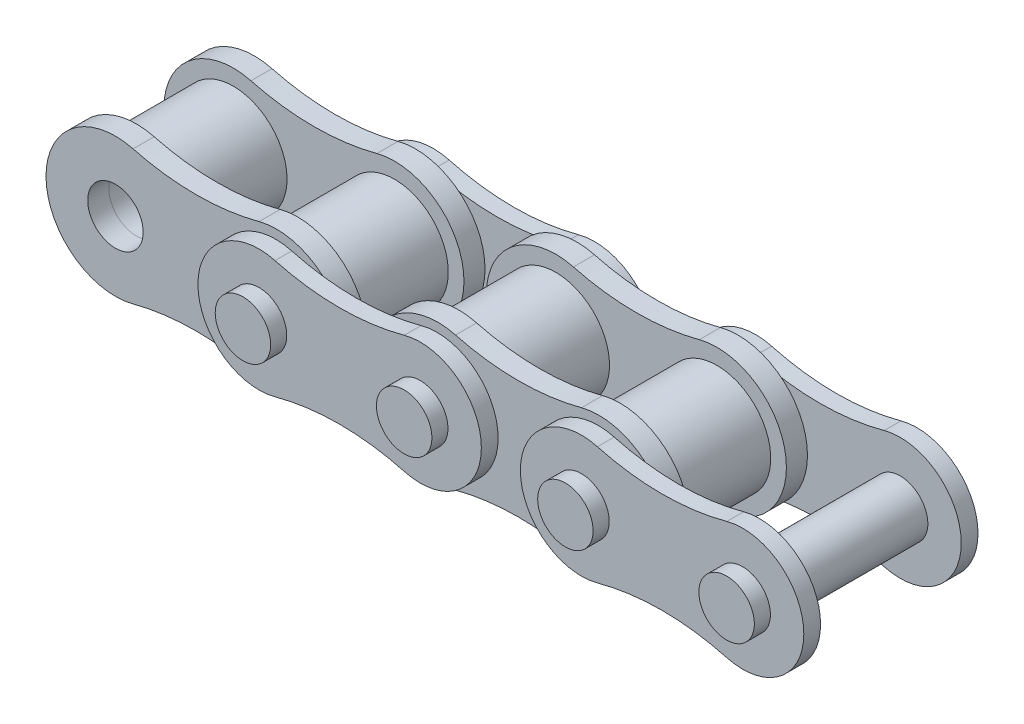
from build123d import *

# Parameters (mm, degrees)
SKETCH4_R                  = 3.175
SKETCH4_R_2                = 1.6637
BOSS_EXTRUDE1_DEPTH        = 2.86
BOSS_EXTRUDE1_2_DEPTH      = 2.86
SKETCH5_R                  = 1.6383
BOSS_EXTRUDE2_DEPTH        = 1.2446
LPATTERN1_COUNT            = 2
LPATTERN1_PITCH            = 9.525
SKETCH7_R                  = 1.6383
BOSS_EXTRUDE3_DEPTH        = 0.9906
BOSS_EXTRUDE4_DEPTH        = 6.096
BOSS_EXTRUDE4_DEPTH_BACK   = 6.096
SKETCH8_R                  = 1.6383
BOSS_EXTRUDE4_2_DEPTH      = 6.096
BOSS_EXTRUDE4_2_DEPTH_BACK = 6.096
LPATTERN2_COUNT            = 2
LPATTERN2_PITCH            = 19.05


with BuildPart() as part:
    # Sketch4 → Boss-Extrude1 (new, symmetric)
    with BuildSketch(Plane.XY):
        with Locations((-4.7625, 0)):
            Circle(SKETCH4_R)
        with Locations((-4.7625, 0)):
            Circle(SKETCH4_R_2, mode=Mode.SUBTRACT)
    extrude(amount=BOSS_EXTRUDE1_DEPTH, both=True)


with BuildPart() as body_2:
    # Sketch4 → Boss-Extrude1 2 (new, symmetric)
    with BuildSketch(Plane.XY):
        with Locations((4.7625, 0)):
            Circle(SKETCH4_R)
        with Locations((4.7625, 0)):
            Circle(SKETCH4_R_2, mode=Mode.SUBTRACT)
    extrude(amount=BOSS_EXTRUDE1_2_DEPTH, both=True)


with BuildPart() as body_3:
    # Sketch5 → Boss-Extrude2 (new body)
    with BuildSketch(Plane.XY.offset(2.86)):
        with BuildLine():
            ThreePointArc((-3.71992076, 3.967398762), (-8.8646, 0), (-3.71992076, -3.967398762))
            ThreePointArc((-3.71992076, -3.967398762), (0, -3.486785), (3.71992076, -3.967398762))
            ThreePointArc((3.71992076, -3.967398762), (8.8646, 0), (3.71992076, 3.967398762))
            ThreePointArc((3.71992076, 3.967398762), (0, 3.486785), (-3.71992076, 3.967398762))
        make_face()
        with Locations((-4.7625, 0)):
            Circle(SKETCH5_R, mode=Mode.SUBTRACT)
        with Locations((4.7625, 0)):
            Circle(SKETCH5_R, mode=Mode.SUBTRACT)
    extrude(amount=BOSS_EXTRUDE2_DEPTH)


with BuildPart() as lpattern1_1:
    # LPattern1: pattern copy
    add(body_2.part.moved(Location(Vector(1, 0, 0) * (1 * LPATTERN1_PITCH))))


with BuildPart() as body_5:
    # Sketch7 → Boss-Extrude3 (new body)
    with BuildSketch(Plane.XY.offset(-4.1554)):
        with BuildLine():
            ThreePointArc((5.704721623, 3.48471247), (1.152652, 0), (5.704721623, -3.48471247))
            ThreePointArc((5.704721623, -3.48471247), (9.525, -2.977345042), (13.345278377, -3.48471247))
            ThreePointArc((13.345278377, -3.48471247), (17.897348, 0), (13.345278377, 3.48471247))
            ThreePointArc((13.345278377, 3.48471247), (9.525, 2.977345042), (5.704721623, 3.48471247))
        make_face()
        with Locations((4.7625, 0)):
            Circle(SKETCH7_R, mode=Mode.SUBTRACT)
        with Locations((14.2875, 0)):
            Circle(SKETCH7_R, mode=Mode.SUBTRACT)
    extrude(amount=-BOSS_EXTRUDE3_DEPTH)


with BuildPart() as body_6:
    # Mirror1: mirrored copy
    add(body_3.part.mirror(Plane.XY))


with BuildPart() as body_7:
    # Mirror1 2: mirrored copy
    add(body_5.part.mirror(Plane.XY))


with BuildPart() as body_8:
    # Sketch8 → Boss-Extrude4 (new, two sides: drawn at the far end of the back side and taken through both)
    with BuildSketch(Plane.XY.offset(-BOSS_EXTRUDE4_DEPTH_BACK)):
        with Locations(Location((4.7625, 0, 0), (0, 0, 180))):
            Circle(SKETCH8_R)
    extrude(amount=BOSS_EXTRUDE4_DEPTH + BOSS_EXTRUDE4_DEPTH_BACK)


with BuildPart() as body_9:
    # Sketch8 → Boss-Extrude4 2 (new, two sides: drawn at the far end of the back side and taken through both)
    with BuildSketch(Plane.XY.offset(-BOSS_EXTRUDE4_2_DEPTH_BACK)):
        with Locations(Location((14.2875, 0, 0), (0, 0, 180))):
            Circle(SKETCH8_R)
    extrude(amount=BOSS_EXTRUDE4_2_DEPTH + BOSS_EXTRUDE4_2_DEPTH_BACK)


with BuildPart() as lpattern2_1:
    # LPattern2: pattern copy
    add(body_9.part.moved(Location(Vector(1, 0, 0) * (1 * LPATTERN2_PITCH))))


with BuildPart() as lpattern2_2:
    # LPattern2: pattern copy
    add(body_8.part.moved(Location(Vector(1, 0, 0) * (1 * LPATTERN2_PITCH))))


with BuildPart() as lpattern2_3:
    # LPattern2: pattern copy
    add(body_7.part.moved(Location(Vector(1, 0, 0) * (1 * LPATTERN2_PITCH))))


with BuildPart() as lpattern2_4:
    # LPattern2: pattern copy
    add(body_6.part.moved(Location(Vector(1, 0, 0) * (1 * LPATTERN2_PITCH))))


with BuildPart() as lpattern2_5:
    # LPattern2: pattern copy
    add(body_5.part.moved(Location(Vector(1, 0, 0) * (1 * LPATTERN2_PITCH))))


with BuildPart() as lpattern2_6:
    # LPattern2: pattern copy
    add(lpattern1_1.part.moved(Location(Vector(1, 0, 0) * (1 * LPATTERN2_PITCH))))


with BuildPart() as lpattern2_7:
    # LPattern2: pattern copy
    add(body_3.part.moved(Location(Vector(1, 0, 0) * (1 * LPATTERN2_PITCH))))


with BuildPart() as lpattern2_8:
    # LPattern2: pattern copy
    add(body_2.part.moved(Location(Vector(1, 0, 0) * (1 * LPATTERN2_PITCH))))


with BuildPart() as lpattern2_9:
    # LPattern2: pattern copy
    add(part.part.moved(Location(Vector(1, 0, 0) * (1 * LPATTERN2_PITCH))))


with BuildPart() as body_2_1:
    add(body_2.part)

    # Combine1: union body 3, LPattern1_1, body 5, body 6, body 7, body 8, body 9, LPattern2_1, LPattern2_2, LPattern2_3, LPattern2_4, LPattern2_5, LPattern2_7, LPattern2_8, LPattern2_9, part
    add(body_3.part)
    add(lpattern1_1.part)
    add(body_5.part)
    add(body_6.part)
    add(body_7.part)
    add(body_8.part)
    add(body_9.part)
    add(lpattern2_1.part)
    add(lpattern2_2.part)
    add(lpattern2_3.part)
    add(lpattern2_4.part)
    add(lpattern2_5.part)
    add(lpattern2_7.part)
    add(lpattern2_8.part)
    add(lpattern2_9.part)
    add(part.part)


solid = body_2_1.part
